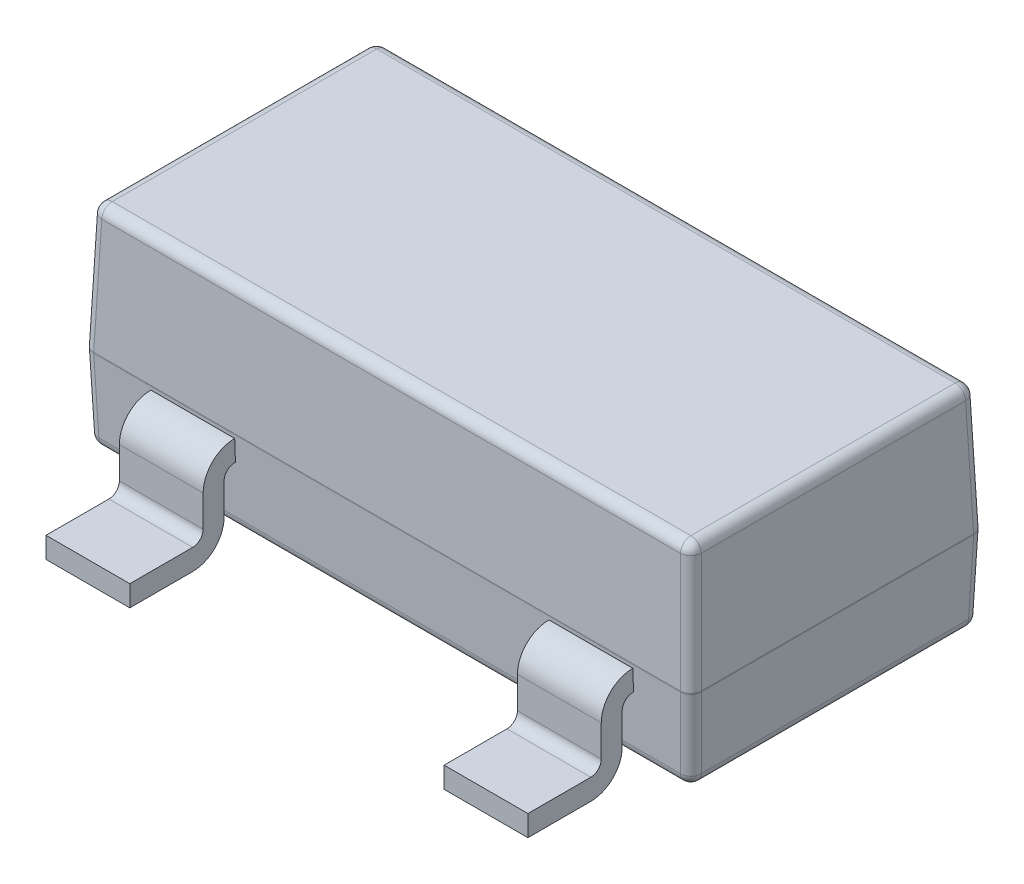
from build123d import *

# Parameters (mm, degrees)
SKETCH1_W                = 2.9
SKETCH1_H                = 1.4
EXTRUDE1_DEPTH           = 0.6
EXTRUDE1_TAPER           = 2
EXTRUDE1_OTHER_WAY_DEPTH = 0.4
EXTRUDE1_OTHER_WAY_TAPER = 2
FILLET1_R                = 0.05
SKETCH4_W                = 0.4
SKETCH4_H                = 0.1
SKETCH6_W                = 0.4
SKETCH6_H                = 0.1
LPATTERN1_COUNT          = 2
LPATTERN1_PITCH          = 1.9


with BuildPart() as part:
    # Sketch1 → Extrude1 (new body)
    with BuildSketch(Plane(origin=(0, 0, 0), x_dir=(1, 0, 0), z_dir=(0, 1, 0))):
        with Locations((-0.022336989, 0.003590633)):
            Rectangle(SKETCH1_W, SKETCH1_H)
    extrude(amount=EXTRUDE1_DEPTH, taper=EXTRUDE1_TAPER)

    # Sketch1 → Extrude1 other way (add)
    with BuildSketch(Plane(origin=(0, 0, 0), x_dir=(1, 0, 0), z_dir=(0, 1, 0))):
        with Locations((-0.022336989, 0.003590633)):
            Rectangle(SKETCH1_W, SKETCH1_H)
    extrude(amount=-EXTRUDE1_OTHER_WAY_DEPTH, taper=EXTRUDE1_OTHER_WAY_TAPER)

    # Fillet1
    fillet1_edges = [part.edges().sort_by_distance(p)[0] for p in [
        (1.406710549, 0.6, -0.003590633),
        (-1.458368681, -0.4, -0.003590633),
        (-1.465352835, -0.2, 0.689425213),
        (-0.022336989, -0.4, -0.689622325),
        (-1.465352835, -0.2, -0.696606479),
        (1.413694703, -0.4, -0.003590633),
        (-0.022336989, 0.6, -0.682638171),
        (1.420678857, -0.2, -0.696606479),
        (-0.022336989, -0.4, 0.682441059),
        (1.420678857, -0.2, 0.689425213),
        (-1.451384528, 0.6, -0.003590633),
        (-0.022336989, 0, -0.703590633),
        (1.427663011, 0, -0.003590633),
        (-0.022336989, 0, 0.696409367),
        (-1.472336989, 0, -0.003590633),
        (-0.022336989, 0.6, 0.675456905),
        (-1.461860758, 0.3, -0.693114402),
        (1.41718678, 0.3, -0.693114402),
        (1.41718678, 0.3, 0.685933136),
        (-1.461860758, 0.3, 0.685933136),
    ]]
    fillet(fillet1_edges, radius=FILLET1_R)

    # Sweep2: sweep along a path in Sketch2
    with BuildLine(Plane(origin=(0, 0, 0), x_dir=(0, 0, -1), z_dir=(1, 0, 0))) as sweep2_path:
        Line((0, -0.071744975), (0.703590633, -0.071744975))
        ThreePointArc((0.703590633, -0.071744975), (0.774301311, -0.101034297), (0.803590633, -0.171744975))
        Line((0.803590633, -0.171744975), (0.803590633, -0.321744975))
        ThreePointArc((0.803590633, -0.321744975), (0.832879955, -0.392455653), (0.903590633, -0.421744975))
        Line((0.903590633, -0.421744975), (1.203590633, -0.421744975))
    # Sketch4 → Sweep2 (sweep)
    with BuildSketch(Plane.XY):
        with Locations((0, -0.071744975)):
            Rectangle(SKETCH4_W, SKETCH4_H)
    sweep(path=sweep2_path.line)

    # Sweep3: sweep along a path in Sketch5
    with BuildLine(Plane(origin=(0.95, 0, 0), x_dir=(0, 0, -1), z_dir=(1, 0, 0))) as sweep3_path:
        Line((0, -0.068255025), (-0.696409367, -0.068255025))
        ThreePointArc((-0.696409367, -0.068255025), (-0.767120045, -0.097544347), (-0.796409367, -0.168255025))
        Line((-0.796409367, -0.168255025), (-0.796409367, -0.318255025))
        ThreePointArc((-0.796409367, -0.318255025), (-0.825698689, -0.388965703), (-0.896409367, -0.418255025))
        Line((-0.896409367, -0.418255025), (-1.196409367, -0.418255025))
    # Sketch6 → Sweep3 (sweep)
    with BuildSketch(Plane.XY):
        with Locations((0.95, -0.068255025)):
            Rectangle(SKETCH6_W, SKETCH6_H)
    sweep3 = sweep(path=sweep3_path.line)

    # LPattern1: Sweep3 ×2
    with Locations(*[(-i * LPATTERN1_PITCH, 0, 0) for i in range(1, LPATTERN1_COUNT)]):
        add(sweep3)


solid = part.part
